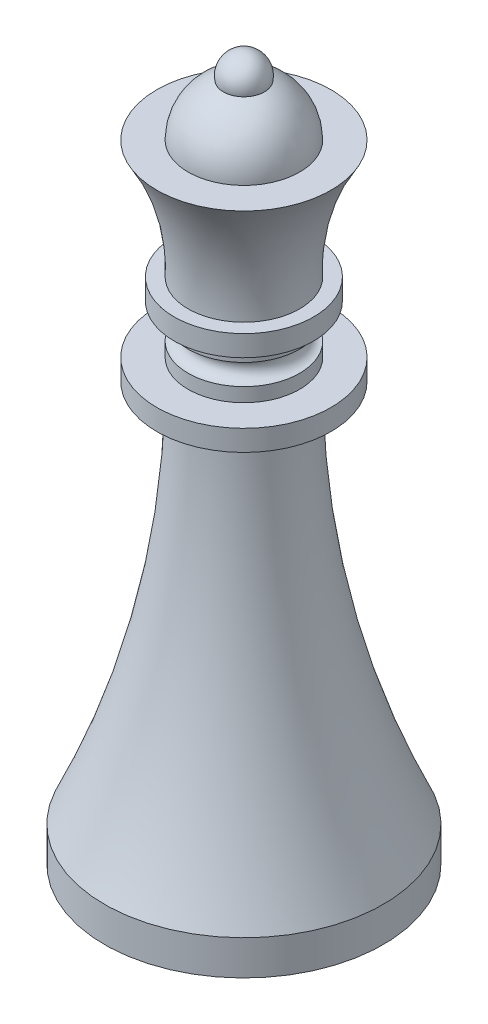
from build123d import *

# Parameters (mm, degrees)
FILLET1_R     = 2
SCALE_1_SCALE = 0.6


with BuildPart() as part:
    # Sketch1 → Revolve1 (revolve)
    with BuildSketch(Plane.XY, mode=Mode.PRIVATE) as revolve1_sk:
        with BuildLine():
            Line((0, -60), (20, -60))
            Line((20, -60), (20, -55))
            ThreePointArc((20, -55), (11.03487717, -28.14693589), (8, 0))
            Line((8, 0), (12.5, 0))
            Line((12.5, 0), (12.5, 3))
            Line((12.5, 3), (8, 3))
            Line((8, 3), (8, 5))
            ThreePointArc((8, 5), (6.5, 6.5), (8, 8))
            Line((8, 8), (8, 10))
            Line((8, 10), (10, 10))
            Line((10, 10), (10, 13))
            Line((10, 13), (8, 13))
            ThreePointArc((8, 13), (8.976394405, 21.837130893), (12.5, 30))
            Line((12.5, 30), (8, 30))
            ThreePointArc((8, 30), (6.617187865, 34.495867521), (2.946793809, 37.4375))
            ThreePointArc((2.946793809, 37.4375), (2.311655251, 39.912132318), (0, 41))
            Line((0, 41), (0, -60))
        make_face()
    revolve(revolve1_sk.sketch.rotate(Axis((0, 50, 0), (0, -1, 0)), 180), axis=Axis((0, 50, 0), (0, -1, 0)))

    # Fillet1
    fillet1_edges = [part.edges().sort_by_distance(p)[0] for p in [
        (8, 0, 0),
    ]]
    fillet(fillet1_edges, radius=FILLET1_R)


with BuildPart() as part_1:
    # 缩放比例1: scaled about (0, 0, 0)
    add(part.part.scale(SCALE_1_SCALE))


solid = part_1.part
